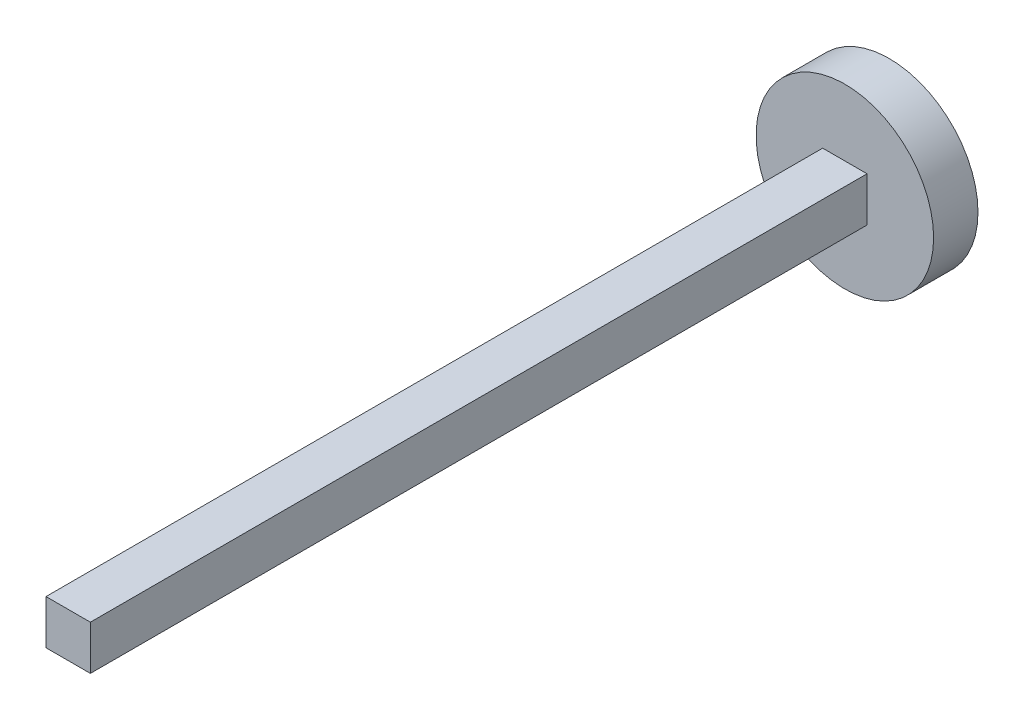
from build123d import *

# Parameters (mm, degrees)
SKETCH1_R           = 40
BOSS_EXTRUDE1_DEPTH = 20
SKETCH2_W           = 20
SKETCH2_H           = 20
BOSS_EXTRUDE2_DEPTH = 350


with BuildPart() as part:
    # Sketch1 → Boss-Extrude1 (new body)
    with BuildSketch(Plane.XY):
        Circle(SKETCH1_R)
    extrude(amount=BOSS_EXTRUDE1_DEPTH)

    # Sketch2 → Boss-Extrude2 (add)
    with BuildSketch(Plane.XY.offset(20)):
        Rectangle(SKETCH2_W, SKETCH2_H)
    extrude(amount=BOSS_EXTRUDE2_DEPTH)


solid = part.part
